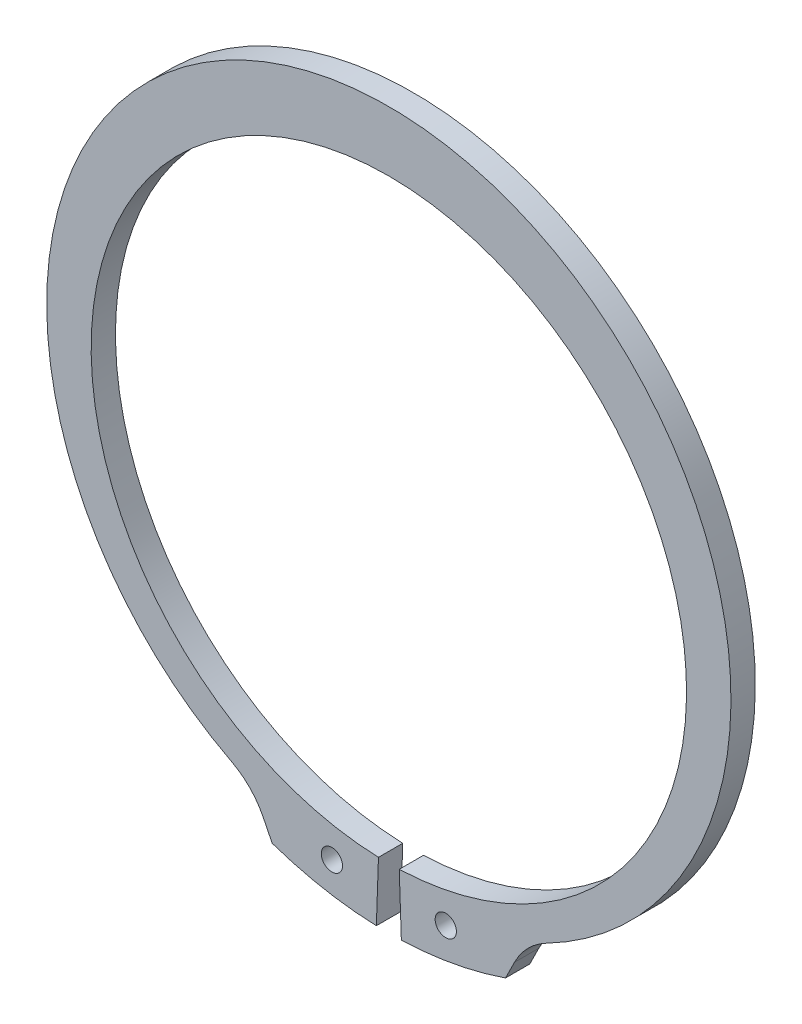
from build123d import *

# Parameters (mm, degrees)
SKETCH4_R           = 1.75
BOSS_EXTRUDE1_DEPTH = 2
FILLET1_R           = 12.038964726


with BuildPart() as part:
    # Sketch4 → Boss-Extrude1 (new, symmetric)
    with BuildSketch(Plane.XY):
        with BuildLine():
            Line((-19.20029003, -55.720637345), (-22.533190866, -49.018953573))
            ThreePointArc((-22.533190866, -49.018953573), (-55.123146751, 14.097654643), (0, 58.9))
            Line((0, 58.9), (0, 49))
            ThreePointArc((0, 49), (-48.992537063, 0.855167915), (-1.710075338, -48.970150524))
            Line((-1.710075338, -48.970150524), (-2.056833323, -58.9))
            ThreePointArc((-2.056833323, -58.9), (-10.746786033, -57.947796794), (-19.20029003, -55.720637345))
        make_face()
        with Locations((-9.371436357, -53.148056637)):
            Circle(SKETCH4_R, mode=Mode.SUBTRACT)
    extrude(amount=BOSS_EXTRUDE1_DEPTH, both=True)

    # Fillet1
    fillet1_edges = [part.edges().sort_by_distance(p)[0] for p in [
        (-22.533190866, -49.018953573, 0),
    ]]
    fillet(fillet1_edges, radius=FILLET1_R)

    # Mirror1: part across plane


with BuildPart() as part_1:
    add(part.part)
    add(part.part.mirror(Plane(origin=(0, 58.9, 2), x_dir=(0, 0, 1), z_dir=(-1, 0, 0))))


solid = part_1.part
